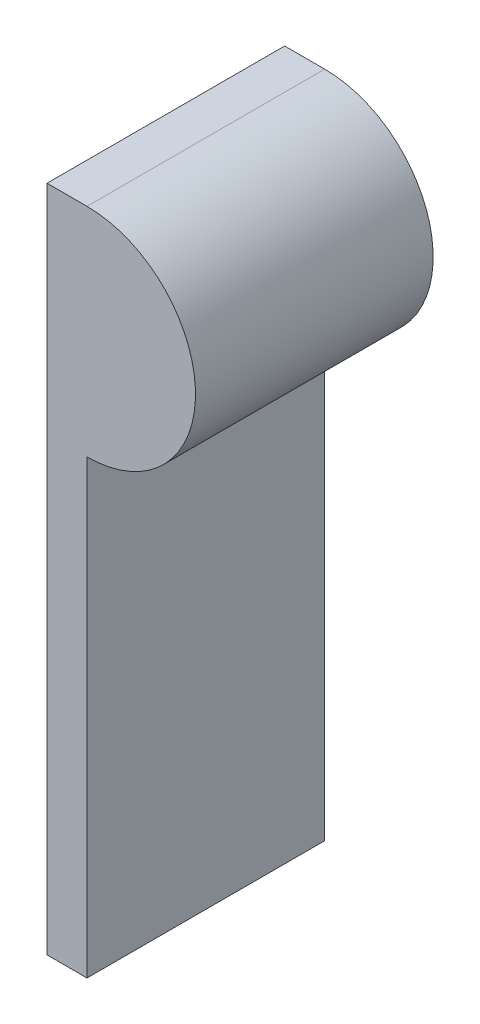
from build123d import *

# Parameters (mm, degrees)
EXTRUDE_1_DEPTH = 10


with BuildPart() as part:
    # 草图2 → 凸台-拉伸1 (new body)
    with BuildSketch(Plane.XY):
        with BuildLine():
            Line((0, 0.86908517), (0, 28.986682774))
            Line((0, 28.986682774), (1.683555532, 28.986682774))
            ThreePointArc((1.683555532, 28.986682774), (6.247793719, 24.422444587), (1.683555532, 19.858206401))
            Line((1.683555532, 19.858206401), (1.683555532, 0.86908517))
            Line((1.683555532, 0.86908517), (0, 0.86908517))
        make_face()
    extrude(amount=EXTRUDE_1_DEPTH)


solid = part.part
